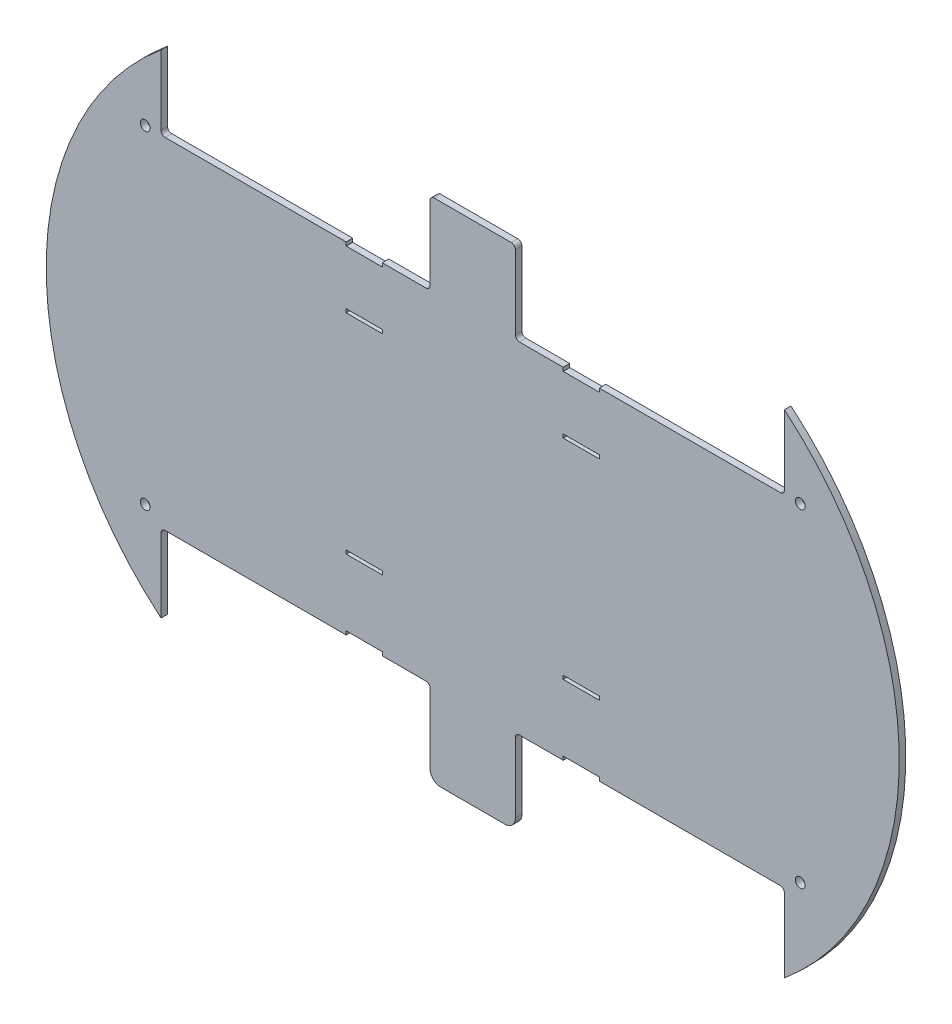
from build123d import *

# Parameters (mm, degrees)
SZKIC1_R                    = 1.5
SZKIC1_W                    = 11
SZKIC1_H                    = 1.1
DODANIE_WYCI_GNI_CIE3_DEPTH = 2


with BuildPart() as part:
    # Szkic1 → Dodanie-wyciągnięcie3 (new body)
    with BuildSketch(Plane.XY):
        with BuildLine():
            Line((-139.727293062, -79.5), (-120.189002398, -79.5))
            ThreePointArc((-120.189002398, -79.5), (-117.912369122, -78.544329486), (-117, -76.25))
            Line((-117, -76.25), (-117, -54.98069498))
            ThreePointArc((-117, -54.98069498), (-116.639537786, -54.110462214), (-115.76930502, -53.75))
            Line((-115.76930502, -53.75), (-102.427025017, -53.75))
            Line((-102.427025017, -53.75), (-102.427025017, -52.65))
            Line((-102.427025017, -52.65), (-91.427025017, -52.65))
            Line((-91.427025017, -52.65), (-91.427025017, -53.75))
            Line((-91.427025017, -53.75), (-87.218924948, -53.75))
            Line((-87.218924948, -53.75), (-36.25, -53.75))
            ThreePointArc((-36.25, -53.75), (-35.366116524, -54.116116524), (-35, -55))
            Line((-35, -55), (-35, -77.5))
            ThreePointArc((-35, -77.5), (0, -2.5), (-35, 72.5))
            Line((-35, 72.5), (-35, 51.25))
            ThreePointArc((-35, 51.25), (-35.366116524, 50.366116524), (-36.25, 50))
            Line((-36.25, 50), (-91.427025017, 50))
            Line((-91.427025017, 50), (-91.427025017, 48.9))
            Line((-91.427025017, 48.9), (-102.427025017, 48.9))
            Line((-102.427025017, 48.9), (-102.427025017, 50))
            Line((-102.427025017, 50), (-115.75, 50))
            ThreePointArc((-115.75, 50), (-116.633883476, 50.366116524), (-117, 51.25))
            Line((-117, 51.25), (-117, 73.75))
            ThreePointArc((-117, 73.75), (-117.366116524, 74.633883476), (-118.25, 75))
            Line((-118.25, 75), (-141.75, 75))
            ThreePointArc((-141.75, 75), (-142.633883476, 74.633883476), (-143, 73.75))
            Line((-143, 73.75), (-143, 51.25))
            ThreePointArc((-143, 51.25), (-143.366116524, 50.366116524), (-144.25, 50))
            Line((-144.25, 50), (-157.572974983, 50))
            Line((-157.572974983, 50), (-157.572974983, 48.9))
            Line((-157.572974983, 48.9), (-168.572974983, 48.9))
            Line((-168.572974983, 48.9), (-168.572974983, 50))
            Line((-168.572974983, 50), (-223.75, 50))
            ThreePointArc((-223.75, 50), (-224.633883476, 50.366116524), (-225, 51.25))
            Line((-225, 51.25), (-225, 72.5))
            ThreePointArc((-225, 72.5), (-260, -2.5), (-225, -77.5))
            Line((-225, -77.5), (-225, -55))
            ThreePointArc((-225, -55), (-224.633883476, -54.116116524), (-223.75, -53.75))
            Line((-223.75, -53.75), (-172.781075052, -53.75))
            Line((-172.781075052, -53.75), (-168.572974983, -53.75))
            Line((-168.572974983, -53.75), (-168.572974983, -52.65))
            Line((-168.572974983, -52.65), (-166.090308712, -52.65))
            Line((-166.090308712, -52.65), (-157.572974983, -52.65))
            Line((-157.572974983, -52.65), (-157.572974983, -53.75))
            Line((-157.572974983, -53.75), (-144.25, -53.75))
            ThreePointArc((-144.25, -53.75), (-143.366116524, -54.116116524), (-143, -55))
            Line((-143, -55), (-143, -76.237644119))
            ThreePointArc((-143, -76.237644119), (-142.040816528, -78.548140635), (-139.727293062, -79.5))
        make_face()
        with Locations((-229.818345238, 50.110219647)):
            Circle(SZKIC1_R, mode=Mode.SUBTRACT)
        with Locations((-229.818345238, -49.889780353)):
            Circle(SZKIC1_R, mode=Mode.SUBTRACT)
        with Locations(Location((-30.181654762, -49.889780353, 0), (0, 0, 180))):
            Circle(SZKIC1_R, mode=Mode.SUBTRACT)
        with Locations(Location((-30.181654762, 50.110219647, 0), (0, 0, 180))):
            Circle(SZKIC1_R, mode=Mode.SUBTRACT)
        with Locations((-163.072974983, -31.85)):
            Rectangle(SZKIC1_W, SZKIC1_H, mode=Mode.SUBTRACT)
        with Locations((-163.072974983, 31.85)):
            Rectangle(SZKIC1_W, SZKIC1_H, mode=Mode.SUBTRACT)
        with Locations((-96.927025017, 31.85)):
            Rectangle(SZKIC1_W, SZKIC1_H, mode=Mode.SUBTRACT)
        with Locations((-96.927025017, -31.85)):
            Rectangle(SZKIC1_W, SZKIC1_H, mode=Mode.SUBTRACT)
    extrude(amount=DODANIE_WYCI_GNI_CIE3_DEPTH)


solid = part.part
